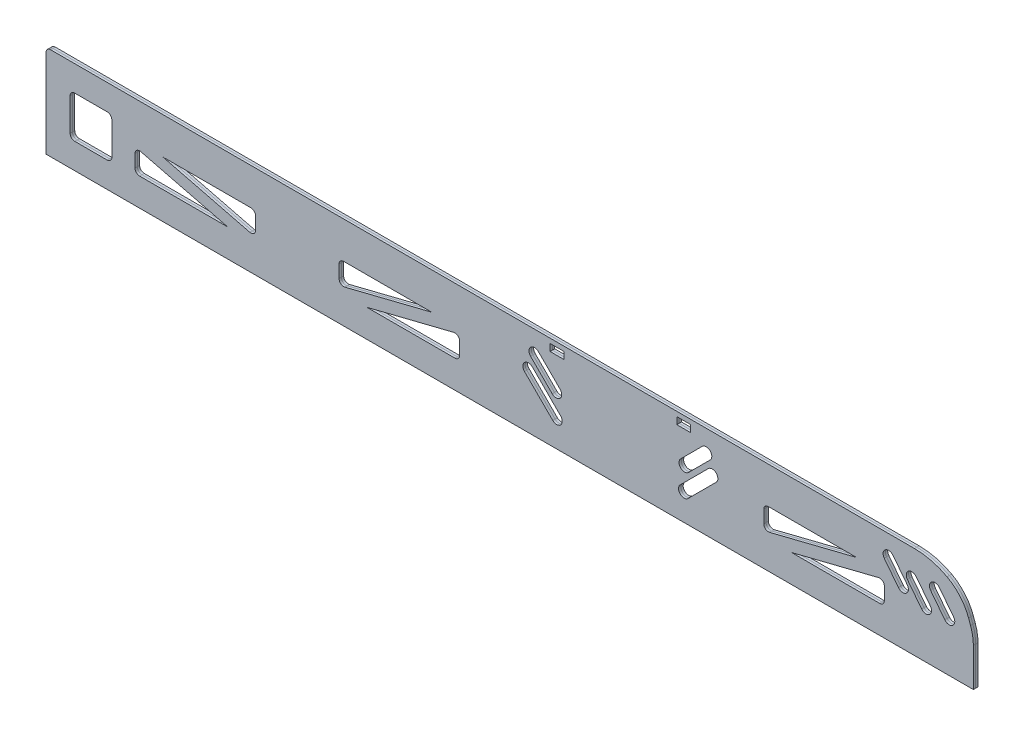
from build123d import *

# Parameters (mm, degrees)
SKETCH1_W           = 9
SKETCH1_H           = 9
SKETCH1_W_2         = 3
SKETCH1_H_2         = 1.5
BOSS_EXTRUDE1_DEPTH = 0.5
FILLET1_R           = 10
FILLET3_R           = 1


with BuildPart() as part:
    # Sketch1 → Boss-Extrude1 (new, symmetric)
    with BuildSketch(Plane.XY):
        with BuildLine():
            Line((-200, 10), (-200, 20))
            Line((-200, 20), (-12.686273665, 20))
            ThreePointArc((-12.686273665, 20), (-6.83279553, 18.787212337), (-1.943060243, 15.348528137))
            Line((-1.943060243, 15.348528137), (0, 10))
            Line((0, 10), (0, 0))
            Line((0, 0), (-10, 0))
            Line((-10, 0), (-200, 0))
            Line((-200, 0), (-200, 10))
        make_face()
        Polygon((-180.8, 11), (-180.8, 6), (-160.8, 6), align=None, mode=Mode.SUBTRACT)
        with Locations((-190.3, 10)):
            Rectangle(SKETCH1_W, SKETCH1_H, mode=Mode.SUBTRACT)
        Polygon((-154.8, 7.076941016), (-154.8, 12.076941016), (-174.8, 12.076941016), align=None, mode=Mode.SUBTRACT)
        Polygon((-130.8, 6), (-110.8, 11), (-110.8, 6), align=None, mode=Mode.SUBTRACT)
        Polygon((-136.8, 7.076941016), (-136.8, 12.076941016), (-116.8, 12.076941016), align=None, mode=Mode.SUBTRACT)
        with BuildLine():
            Line((-95.102943725, 12.697056275), (-89.021825407, 6.615937957))
            ThreePointArc((-89.021825407, 6.615937957), (-89.021825407, 4.918881682), (-90.718881682, 4.918881682))
            Line((-90.718881682, 4.918881682), (-96.8, 11))
            ThreePointArc((-96.8, 11), (-96.8, 12.697056275), (-95.102943725, 12.697056275))
        make_face(mode=Mode.SUBTRACT)
        with BuildLine():
            Line((-93.794617613, 16.197056275), (-89.127712857, 11.530151519))
            ThreePointArc((-89.127712857, 11.530151519), (-89.127712857, 9.833095244), (-90.824769132, 9.833095244))
            Line((-90.824769132, 9.833095244), (-95.491673888, 14.5))
            ThreePointArc((-95.491673888, 14.5), (-95.491673888, 16.197056275), (-93.794617613, 16.197056275))
        make_face(mode=Mode.SUBTRACT)
        with Locations((-89.794617613, 18.25)):
            Rectangle(SKETCH1_W_2, SKETCH1_H_2, mode=Mode.SUBTRACT)
        with Locations((-62.460808101, 18.25)):
            Rectangle(SKETCH1_W_2, SKETCH1_H_2, mode=Mode.SUBTRACT)
        with BuildLine():
            Line((-58.460808101, 16.197056275), (-63.127712857, 11.530151519))
            ThreePointArc((-63.127712857, 11.530151519), (-63.127712857, 9.833095244), (-61.430656582, 9.833095244))
            Line((-61.430656582, 9.833095244), (-56.763751827, 14.5))
            ThreePointArc((-56.763751827, 14.5), (-56.763751827, 16.197056275), (-58.460808101, 16.197056275))
        make_face(mode=Mode.SUBTRACT)
        with BuildLine():
            Line((-57.152481989, 12.697056275), (-63.233600308, 6.615937957))
            ThreePointArc((-63.233600308, 6.615937957), (-63.233600308, 4.918881682), (-61.536544033, 4.918881682))
            Line((-61.536544033, 4.918881682), (-55.455425715, 11))
            ThreePointArc((-55.455425715, 11), (-55.455425715, 12.697056275), (-57.152481989, 12.697056275))
        make_face(mode=Mode.SUBTRACT)
        Polygon((-25.2, 12.076941016), (-45.2, 7.076941016), (-45.2, 12.076941016), align=None, mode=Mode.SUBTRACT)
        Polygon((-39.2, 6), (-19.2, 11), (-19.2, 6), align=None, mode=Mode.SUBTRACT)
        with BuildLine():
            Line((-17.321963125, 16.390064684), (-14.260022427, 12.437278431))
            ThreePointArc((-14.260022427, 12.437278431), (-14.47382536, 10.753743963), (-16.157359828, 10.967546896))
            Line((-16.157359828, 10.967546896), (-19.219300527, 14.920333149))
            ThreePointArc((-19.219300527, 14.920333149), (-19.005497594, 16.603867617), (-17.321963125, 16.390064684))
        make_face(mode=Mode.SUBTRACT)
        with BuildLine():
            Line((-12.321963125, 14.907009966), (-9.260022427, 10.954223713))
            ThreePointArc((-9.260022427, 10.954223713), (-9.47382536, 9.270689245), (-11.157359828, 9.484492178))
            Line((-11.157359828, 9.484492178), (-14.219300527, 13.437278431))
            ThreePointArc((-14.219300527, 13.437278431), (-14.005497594, 15.120812899), (-12.321963125, 14.907009966))
        make_face(mode=Mode.SUBTRACT)
        with BuildLine():
            Line((-7.321963125, 15.376741501), (-4.260022427, 11.423955248))
            ThreePointArc((-4.260022427, 11.423955248), (-4.47382536, 9.74042078), (-6.157359828, 9.954223713))
            Line((-6.157359828, 9.954223713), (-9.219300527, 13.907009966))
            ThreePointArc((-9.219300527, 13.907009966), (-9.005497594, 15.590544434), (-7.321963125, 15.376741501))
        make_face(mode=Mode.SUBTRACT)
    extrude(amount=BOSS_EXTRUDE1_DEPTH, both=True)

    # Fillet1
    fillet1_edges = [part.edges().sort_by_distance(p)[0] for p in [
        (0, 10, 0),
        (-1.943060243, 15.348528137, 0),
    ]]
    fillet(fillet1_edges, radius=FILLET1_R)

    # Fillet3
    fillet3_edges = [part.edges().sort_by_distance(p)[0] for p in [
        (-200, 20, 0),
        (-154.8, 7.076941016, 0),
        (-154.8, 12.076941016, 0),
        (-180.8, 11, 0),
        (-180.8, 6, 0),
        (-194.8, 14.5, 0),
        (-194.8, 5.5, 0),
        (-185.8, 5.5, 0),
        (-185.8, 14.5, 0),
        (-110.8, 6, 0),
        (-110.8, 11, 0),
        (-136.8, 7.076941016, 0),
        (-136.8, 12.076941016, 0),
        (-45.2, 12.076941016, 0),
        (-45.2, 7.076941016, 0),
        (-19.2, 6, 0),
        (-19.2, 11, 0),
    ]]
    fillet(fillet3_edges, radius=FILLET3_R)


with BuildPart() as body_2:
    # Split1: the piece on the far side of the plane
    add(part.part)
    split(bisect_by=Plane.XY, keep=Keep.BOTTOM)


with BuildPart() as part_1:
    add(part.part)

    # Split1
    split(bisect_by=Plane.XY, keep=Keep.TOP)


solid = Compound([body_2.part, part_1.part])
